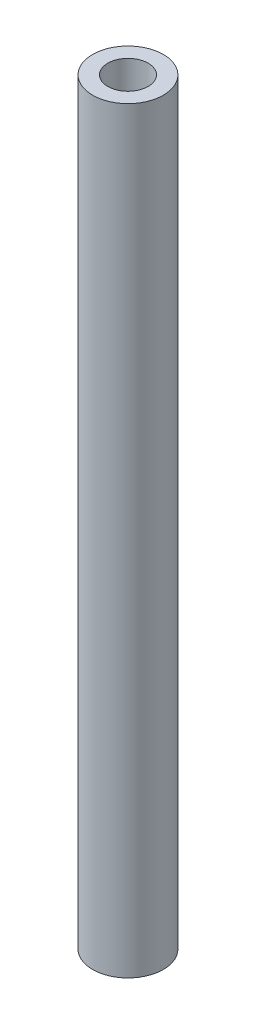
from build123d import *

# Parameters (mm, degrees)
ESBO_O1_W = 1.5
ESBO_O1_H = 75


with BuildPart() as part:
    # Esboço1 → Revolução1 (revolve)
    with BuildSketch(Plane(origin=(0, 0, 0), x_dir=(-1, 0, 0), z_dir=(0, 0, -1)), mode=Mode.PRIVATE) as revolu_o1_sk:
        with Locations((53.96460554, -37.5)):
            Rectangle(ESBO_O1_W, ESBO_O1_H)
    revolve(revolu_o1_sk.sketch.rotate(Axis((-56.71460554, -75, 0), (0, 1, 0)), 180), axis=Axis((-56.71460554, -75, 0), (0, 1, 0)))


solid = part.part
